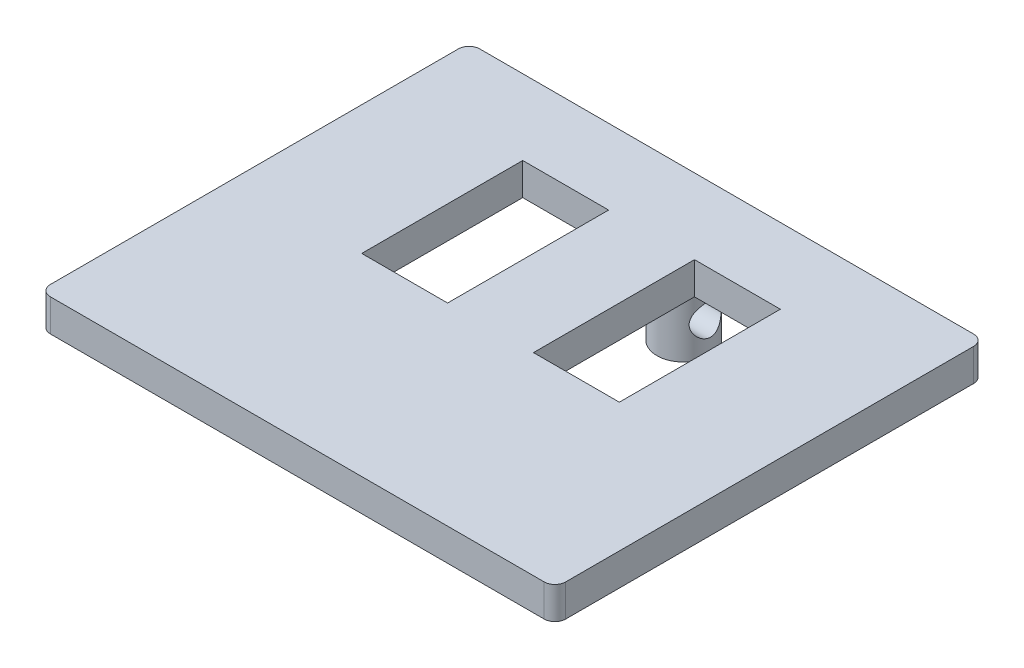
from build123d import *

# Parameters (mm, degrees)
SKETCH1_W               = 8
SKETCH1_H               = 15
BOSS_EXTRUDE1_DEPTH     = 3
SKETCH2_R               = 2.5
BOSS_EXTRUDE2_DEPTH     = 7
CUT_EXTRUDE1_DEPTH      = 8
CUT_EXTRUDE1_DEPTH_BACK = 10
SKETCH3_R               = 1.5


with BuildPart() as part:
    # Sketch1 → Boss-Extrude1 (new body)
    with BuildSketch(Plane(origin=(0, 0, 0), x_dir=(1, 0, 0), z_dir=(0, 1, 0))):
        with BuildLine():
            Line((-23, -20), (23, -20))
            ThreePointArc((23, -20), (23.707106781, -19.707106781), (24, -19))
            Line((24, -19), (24, 19))
            ThreePointArc((24, 19), (23.707106781, 19.707106781), (23, 20))
            Line((23, 20), (-23, 20))
            ThreePointArc((-23, 20), (-23.707106781, 19.707106781), (-24, 19))
            Line((-24, 19), (-24, -19))
            ThreePointArc((-24, -19), (-23.707106781, -19.707106781), (-23, -20))
        make_face()
        with Locations((-8, 5.5)):
            Rectangle(SKETCH1_W, SKETCH1_H, mode=Mode.SUBTRACT)
        with Locations((8, 5.5)):
            Rectangle(SKETCH1_W, SKETCH1_H, mode=Mode.SUBTRACT)
    extrude(amount=BOSS_EXTRUDE1_DEPTH)

    # Sketch2 → Boss-Extrude2 (add)
    with BuildSketch(Plane.XZ):
        with Locations(Location((0, -16, 0), (0, 0, 270))):
            Circle(SKETCH2_R)
    extrude(amount=BOSS_EXTRUDE2_DEPTH)

    # Sketch3 → Cut-Extrude1 (cut, two sides: drawn at the far end of the back side and taken through both)
    with BuildSketch(Plane.ZY.offset(-CUT_EXTRUDE1_DEPTH_BACK)):
        with Locations(Location((-16, -4, 0), (0, 0, 180))):
            Circle(SKETCH3_R)
    extrude(amount=CUT_EXTRUDE1_DEPTH + CUT_EXTRUDE1_DEPTH_BACK, mode=Mode.SUBTRACT)


solid = part.part
